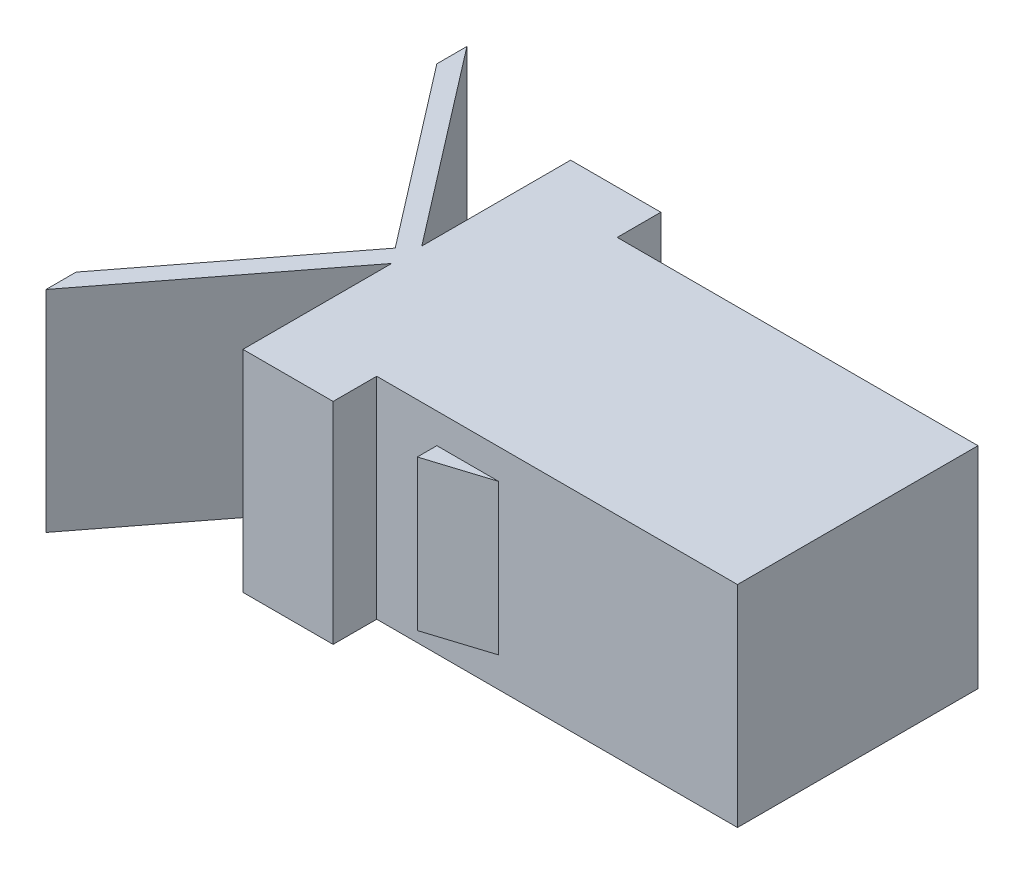
from build123d import *

# Parameters (mm, degrees)
SKETCH_1_W      = 12
SKETCH_1_H      = 8
EXTRUDE_1_DEPTH = 7
EXTRUDE_2_DEPTH = 7
EXTRUDE_5_DEPTH = 7
EXTRUDE_START   = -1
EXTRUDE_6_DEPTH = 5


with BuildPart() as part:
    # 草图1 → 凸台-拉伸1 (new body)
    with BuildSketch(Plane(origin=(0, 0, 0), x_dir=(1, 0, 0), z_dir=(0, 1, 0))):
        with Locations((6, 4)):
            Rectangle(SKETCH_1_W, SKETCH_1_H)
    extrude(amount=EXTRUDE_1_DEPTH)

    # 草图2 → 凸台-拉伸2 (add)
    with BuildSketch(Plane(origin=(0, 7, 0), x_dir=(1, 0, 0), z_dir=(0, 1, 0))):
        Polygon((-3, -1.45), (0, -1.45), (0, 0), (0, 4), (-3, 4), align=None)
        Polygon((-3, 9.45), (-3, 4), (0, 4), (0, 8), (0, 9.45), align=None)
    extrude(amount=-EXTRUDE_2_DEPTH)

    # 草图3 → 凸台-拉伸5 (add)
    with BuildSketch(Plane(origin=(0, 7, 0), x_dir=(1, 0, 0), z_dir=(0, 1, 0))):
        Polygon((-3.384615385, 4), (-3, 4.5), (-8, 11), (-8, 10), align=None)
        Polygon((-3, 3.5), (-3.384615385, 4), (-8, -2), (-8, -3), align=None)
        Polygon((-3, 3.5), (-3, 4.5), (-3.384615385, 4), align=None)
    extrude(amount=-EXTRUDE_5_DEPTH)

    # 草图4 → 凸台-拉伸6 (add)
    with BuildSketch(Plane(origin=(0, 7, 0), x_dir=(1, 0, 0), z_dir=(0, 1, 0)).offset(EXTRUDE_START)):
        Polygon((2, 8), (2, 8.65), (3, 8), align=None)
        Polygon((2, 0), (2, -0.65), (4.058075402, 0), align=None)
    extrude(amount=-EXTRUDE_6_DEPTH)


solid = part.part
